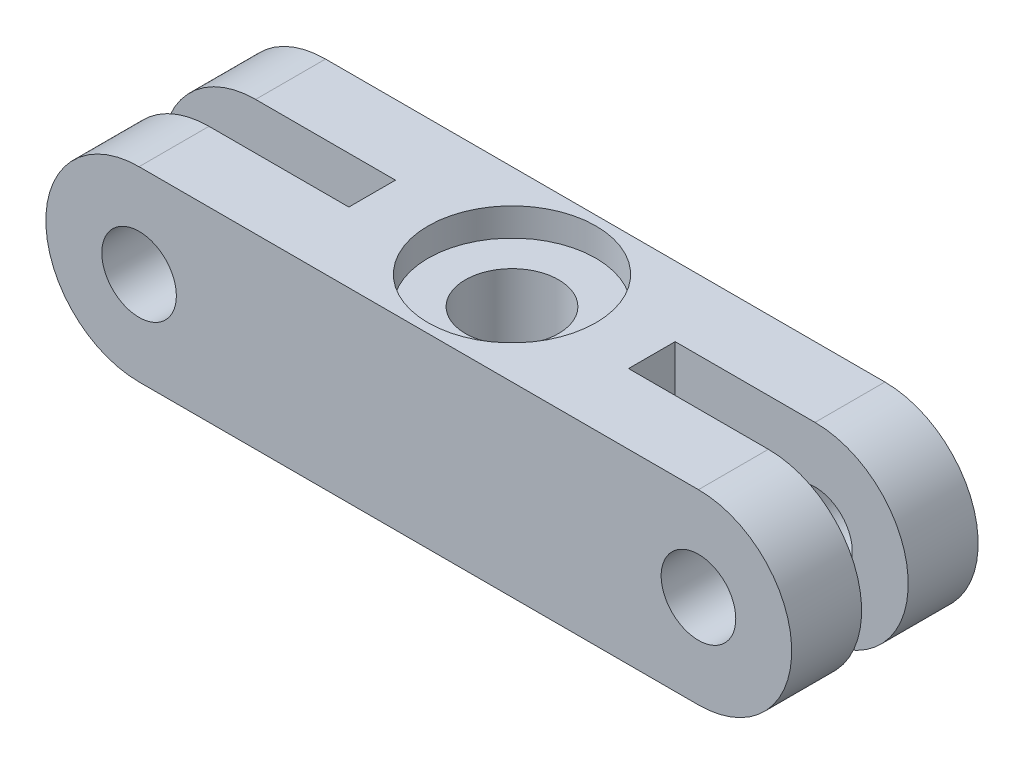
from build123d import *

# Parameters (mm, degrees)
SKETCH1_R               = 4
BOSS_EXTRUDE1_DEPTH     = 10
CUT_EXTRUDE2_DEPTH      = 72.414284285
CUT_EXTRUDE2_DEPTH_BACK = 72.414284285
SKETCH2_W               = 25
SKETCH2_H               = 5
HOLE1_D                 = 10
HOLE1_CBORE_D           = 18
HOLE1_CBORE_DEPTH       = 3


with BuildPart() as part:
    # Sketch1 → Boss-Extrude1 (new, symmetric)
    with BuildSketch(Plane.XY):
        with BuildLine():
            Line((0, 10), (60, 10))
            ThreePointArc((60, 10), (70, 0), (60, -10))
            Line((60, -10), (0, -10))
            ThreePointArc((0, -10), (-10, 0), (0, 10))
        make_face()
        Circle(SKETCH1_R, mode=Mode.SUBTRACT)
        with Locations((60, 0)):
            Circle(SKETCH1_R, mode=Mode.SUBTRACT)
    extrude(amount=BOSS_EXTRUDE1_DEPTH, both=True)

    # Sketch2 → Cut-Extrude2 (cut, two sides: drawn at the far end of the back side and taken through both)
    with BuildSketch(Plane(origin=(0, 0, 0), x_dir=(1, 0, 0), z_dir=(0, 1, 0)).offset(-CUT_EXTRUDE2_DEPTH_BACK)):
        with Locations((57.5, 0)):
            Rectangle(SKETCH2_W, SKETCH2_H)
        with Locations((2.5, 0)):
            Rectangle(SKETCH2_W, SKETCH2_H)
    extrude(amount=CUT_EXTRUDE2_DEPTH + CUT_EXTRUDE2_DEPTH_BACK, mode=Mode.SUBTRACT)

    # Hole1 (through all)
    with Locations(Plane(origin=(0, 10, 0), x_dir=(1, 0, 0), z_dir=(0, 1, 0))):
        with Locations((30, 0)):
            CounterBoreHole(HOLE1_D / 2, HOLE1_CBORE_D / 2, HOLE1_CBORE_DEPTH)


solid = part.part
